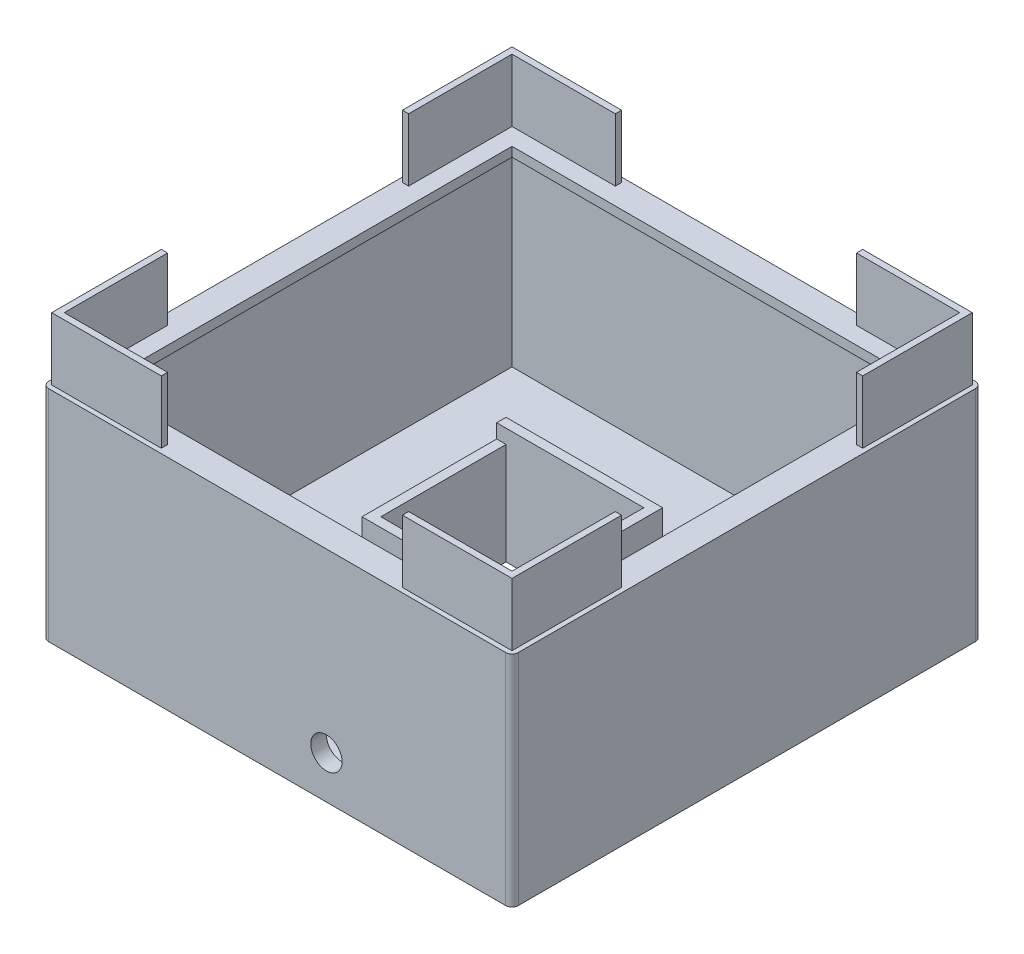
from build123d import *

# Parameters (mm, degrees)
SKETCH1_W           = 150
SKETCH1_H           = 150
BOSS_EXTRUDE1_DEPTH = 70
SHELL1_T            = -5
SKETCH2_W           = 50
SKETCH2_H           = 46
SKETCH2_W_2         = 44
SKETCH2_H_2         = 40
BOSS_EXTRUDE2_DEPTH = 32
CUT_EXTRUDE4_REACH  = 223.867
SKETCH5_W           = 44
SKETCH5_H           = 40
BOSS_EXTRUDE3_DEPTH = 20
SKETCH7_W           = 140
SKETCH7_H           = 140
SKETCH7_W_2         = 132
SKETCH7_H_2         = 132
BOSS_EXTRUDE4_DEPTH = 3
CUT_EXTRUDE5_REACH  = 203.494
SKETCH9_W           = 14
SKETCH9_H           = 15.8
SKETCH10_W          = 14
SKETCH10_H          = 3.5874966
BOSS_EXTRUDE5_DEPTH = 3.5
CUT_EXTRUDE6_REACH  = 225.01
SKETCH11_R          = 1.1
CUT_EXTRUDE8_DEPTH  = 4.5
FILLET1_R           = 2
CUT_EXTRUDE9_DEPTH  = 20.1
SKETCH14_R          = 5
CUT_EXTRUDE11_DEPTH = 20.1


with BuildPart() as part:
    # Sketch1 → Boss-Extrude1 (new body)
    with BuildSketch(Plane(origin=(0, 0, 0), x_dir=(1, 0, 0), z_dir=(0, 1, 0))):
        with Locations((75, 75)):
            Rectangle(SKETCH1_W, SKETCH1_H)
    extrude(amount=BOSS_EXTRUDE1_DEPTH)

    # Shell1
    shell1_openings = [part.faces().sort_by_distance(p)[0] for p in [
        (75, 70, -75),
    ]]
    offset(amount=SHELL1_T, openings=shell1_openings, kind=Kind.INTERSECTION)

    # Sketch2 → Boss-Extrude2 (add)
    with BuildSketch(Plane(origin=(0, 5, 0), x_dir=(1, 0, 0), z_dir=(0, 1, 0))):
        with Locations((75, 75.1)):
            Rectangle(SKETCH2_W, SKETCH2_H)
        with Locations((75, 75.1)):
            Rectangle(SKETCH2_W_2, SKETCH2_H_2, mode=Mode.SUBTRACT)
    extrude(amount=BOSS_EXTRUDE2_DEPTH)

    # Sketch5 → Cut-Extrude4 (cut, up to next)
    with BuildSketch(Plane(origin=(0, 5, 0), x_dir=(1, 0, 0), z_dir=(0, 1, 0)), mode=Mode.PRIVATE) as cut_extrude4_sk1:
        with Locations((75, 75.1)):
            Rectangle(SKETCH5_W, SKETCH5_H)
    cut_extrude4_tool1 = extrude(cut_extrude4_sk1.sketch, amount=-CUT_EXTRUDE4_REACH, mode=Mode.PRIVATE) & part.part
    add(cut_extrude4_tool1.solids().sort_by_distance((75, 5, -75.1))[0], mode=Mode.SUBTRACT)

    # Sketch6 → Boss-Extrude3 (add)
    with BuildSketch(Plane(origin=(0, 70, 0), x_dir=(1, 0, 0), z_dir=(0, 1, 0))):
        Polygon((1.5, 113.5), (1.5, 148.5), (36.5, 148.5), (36.5, 146.5), (3.5, 146.5), (3.5, 113.5), align=None)
        Polygon((1.5, 36.5), (1.5, 1.5), (36.5, 1.5), (36.5, 3.5), (3.5, 3.5), (3.5, 36.5), align=None)
        Polygon((148.5, 36.5), (148.5, 1.5), (113.5, 1.5), (113.5, 3.5), (146.5, 3.5), (146.5, 36.5), align=None)
        Polygon((148.5, 113.5), (148.5, 148.5), (113.5, 148.5), (113.5, 146.5), (146.5, 146.5), (146.5, 113.5), align=None)
    extrude(amount=BOSS_EXTRUDE3_DEPTH)

    # Sketch7 → Boss-Extrude4 (add)
    with BuildSketch(Plane(origin=(0, 70, 0), x_dir=(1, 0, 0), z_dir=(0, 1, 0))):
        with Locations((75, 75)):
            Rectangle(SKETCH7_W, SKETCH7_H)
        with Locations((75, 75)):
            Rectangle(SKETCH7_W_2, SKETCH7_H_2, mode=Mode.SUBTRACT)
    extrude(amount=-BOSS_EXTRUDE4_DEPTH)

    # Sketch9 → Cut-Extrude5 (cut, up to next)
    with BuildSketch(Plane(origin=(100, 0, 0), x_dir=(0, 0, -1), z_dir=(1, 0, 0)), mode=Mode.PRIVATE) as cut_extrude5_sk1:
        with Locations((75.1, 29.1)):
            Rectangle(SKETCH9_W, SKETCH9_H)
    cut_extrude5_tool1 = extrude(cut_extrude5_sk1.sketch, amount=-CUT_EXTRUDE5_REACH, mode=Mode.PRIVATE) & part.part
    add(cut_extrude5_tool1.solids().sort_by_distance((100, 29.1, -75.1))[0], mode=Mode.SUBTRACT)

    # Sketch10 → Boss-Extrude5 (add)
    with BuildSketch(Plane(origin=(100, 0, 0), x_dir=(0, 0, -1), z_dir=(1, 0, 0))):
        with Locations((75.1, 19.4062517)):
            Rectangle(SKETCH10_W, SKETCH10_H)
    extrude(amount=BOSS_EXTRUDE5_DEPTH)

    # Sketch11 → Cut-Extrude6 (cut, up to next)
    with BuildSketch(Plane(origin=(0, 21.2, 0), x_dir=(1, 0, 0), z_dir=(0, 1, 0)), mode=Mode.PRIVATE) as cut_extrude6_sk1:
        with Locations(Location((101.26, 75.55, 0), (0, 0, 270))):
            Circle(SKETCH11_R)
    cut_extrude6_tool1 = extrude(cut_extrude6_sk1.sketch, amount=-CUT_EXTRUDE6_REACH, mode=Mode.PRIVATE) & part.part
    add(cut_extrude6_tool1.solids().sort_by_distance((101.26, 21.2, -75.55))[0], mode=Mode.SUBTRACT)

    # Sketch12 → Cut-Extrude8 (cut)
    with BuildSketch(Plane(origin=(0, 37, 0), x_dir=(1, 0, 0), z_dir=(0, 1, 0))):
        Polygon((53, 95.1), (50, 95.1), (50, 52.1), (100, 52.1), (100, 68.1), (97, 68.1), (97, 55.1), (53, 55.1), align=None)
    extrude(amount=-CUT_EXTRUDE8_DEPTH, mode=Mode.SUBTRACT)

    # Fillet1
    fillet1_edges = [part.edges().sort_by_distance(p)[0] for p in [
        (0, 35, 0),
        (0, 35, -150),
        (150, 35, -150),
        (150, 35, 0),
    ]]
    fillet(fillet1_edges, radius=FILLET1_R)

    # Sketch13 → Cut-Extrude9 (cut)
    with BuildSketch(Plane.XZ):
        Polygon((1.5, -1.5), (36.6, -1.5), (36.6, -3.6), (3.6, -3.6), (3.6, -36.6), (1.5, -36.6), align=None)
        Polygon((148.5, -36.6), (148.5, -1.5), (113.4, -1.5), (113.4, -3.6), (146.4, -3.6), (146.4, -36.6), align=None)
        Polygon((148.5, -148.5), (113.4, -148.5), (113.4, -146.4), (146.4, -146.4), (146.4, -113.4), (148.5, -113.4), align=None)
        Polygon((1.5, -113.4), (1.5, -148.5), (36.6, -148.5), (36.6, -146.4), (3.6, -146.4), (3.6, -113.4), align=None)
    extrude(amount=-CUT_EXTRUDE9_DEPTH, mode=Mode.SUBTRACT)

    # Sketch14 → Cut-Extrude11 (cut)
    with BuildSketch(Plane(origin=(0, 0, -5), x_dir=(-1, 0, 0), z_dir=(0, 0, -1))):
        with Locations((-90.731434744, 13.61525696)):
            Circle(SKETCH14_R)
    extrude(amount=-CUT_EXTRUDE11_DEPTH, mode=Mode.SUBTRACT)


solid = part.part
